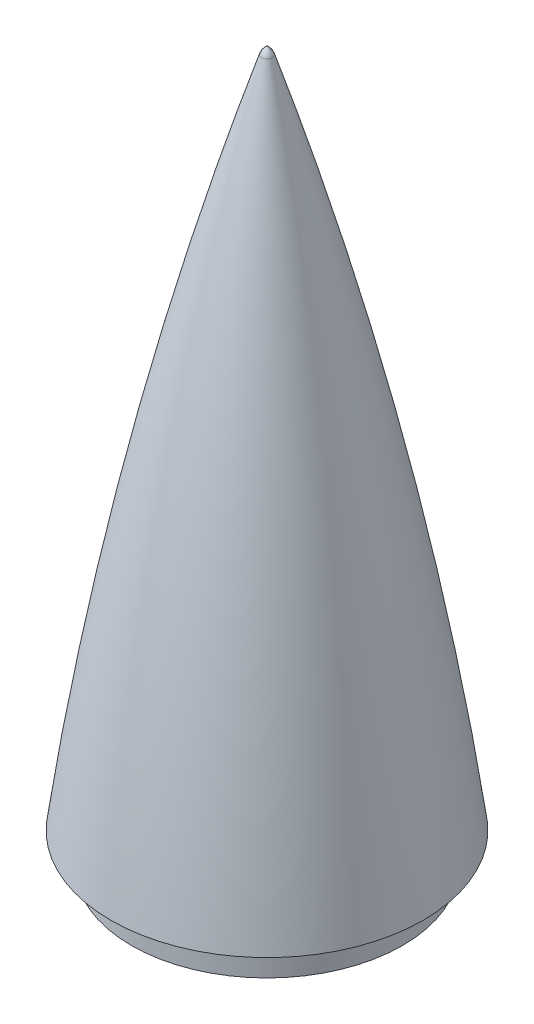
from build123d import *

# Parameters (mm, degrees)
FILLET1_R = 0.762


with BuildPart() as part:
    # Sketch1 → Revolve1 (revolve)
    with BuildSketch(Plane(origin=(0, 0, 0), x_dir=(0, 0, -1), z_dir=(1, 0, 0)), mode=Mode.PRIVATE) as revolve1_sk:
        with BuildLine():
            Line((-39.111921051, 140.208), (-41.674811791, 140.208))
            ThreePointArc((-41.674811791, 140.208), (-25.473113057, 230.655011942), (-1.445569412, 319.344549981))
            ThreePointArc((-1.445569412, 319.344549981), (-0.884364703, 320.44611551), (0, 321.31))
            Line((0, 321.31), (0, 315.496030204))
            ThreePointArc((0, 315.496030204), (-22.725018925, 231.296655423), (-38.384987156, 145.50197847))
            Line((-38.384987156, 145.50197847), (-33.614956524, 142.748))
            Line((-33.614956524, 142.748), (-33.614956524, 131.601387737))
            Line((-33.614956524, 131.601387737), (-36.154956524, 131.601387737))
            Line((-36.154956524, 131.601387737), (-36.154956524, 140.208))
            Line((-36.154956524, 140.208), (-39.111921051, 140.208))
        make_face()
    revolve(revolve1_sk.sketch.rotate(Axis((0, 0, 0), (0, 1, 0)), 180), axis=Axis((0, 0, 0), (0, 1, 0)))

    # Fillet1
    fillet1_edges = [part.edges().sort_by_distance(p)[0] for p in [
        (0, 140.208, 36.154956524),
    ]]
    fillet(fillet1_edges, radius=FILLET1_R)


solid = part.part
